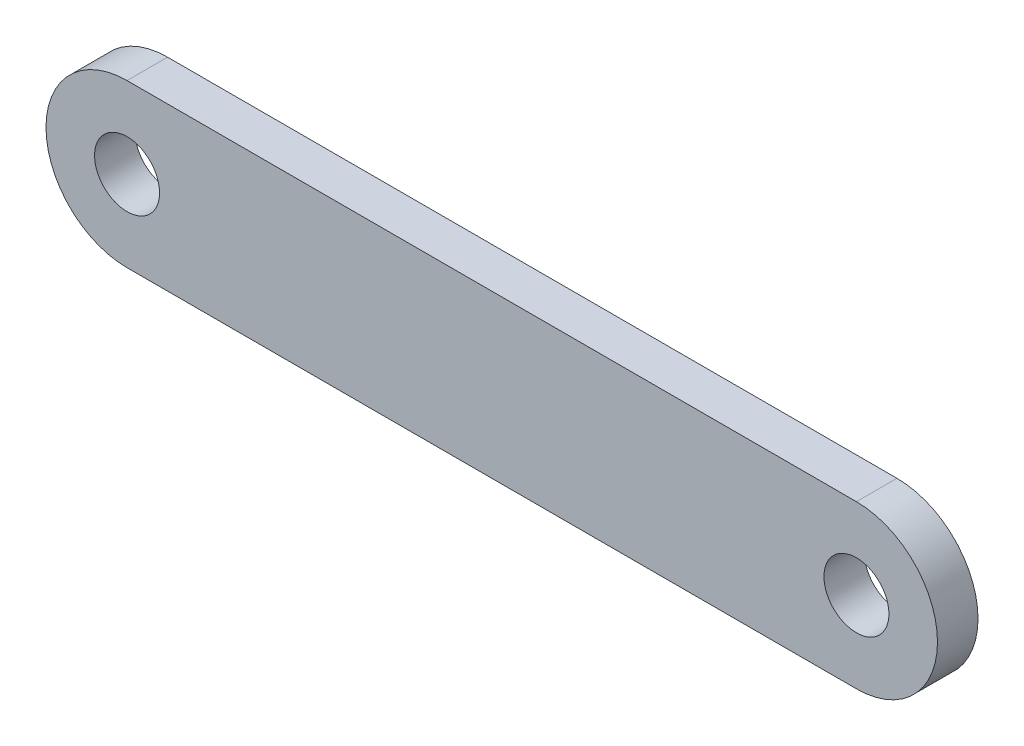
from build123d import *

# Parameters (mm, degrees)
BOSS_EXTRUDE1_DEPTH = 5
SKETCH2_R           = 4.01
CUT_EXTRUDE1_DEPTH  = 10


with BuildPart() as part:
    # Sketch1 → Boss-Extrude1 (new body)
    with BuildSketch(Plane.XY):
        with BuildLine():
            Line((90, 10), (0, 10))
            ThreePointArc((0, 10), (-10, 0), (0, -10))
            Line((0, -10), (90, -10))
            ThreePointArc((90, -10), (100, 0), (90, 10))
        make_face()
    extrude(amount=BOSS_EXTRUDE1_DEPTH)

    # Sketch2 → Cut-Extrude1 (cut)
    with BuildSketch(Plane.XY.offset(5)):
        Circle(SKETCH2_R)
        with Locations((90, 0)):
            Circle(SKETCH2_R)
    extrude(amount=-CUT_EXTRUDE1_DEPTH, mode=Mode.SUBTRACT)


solid = part.part
